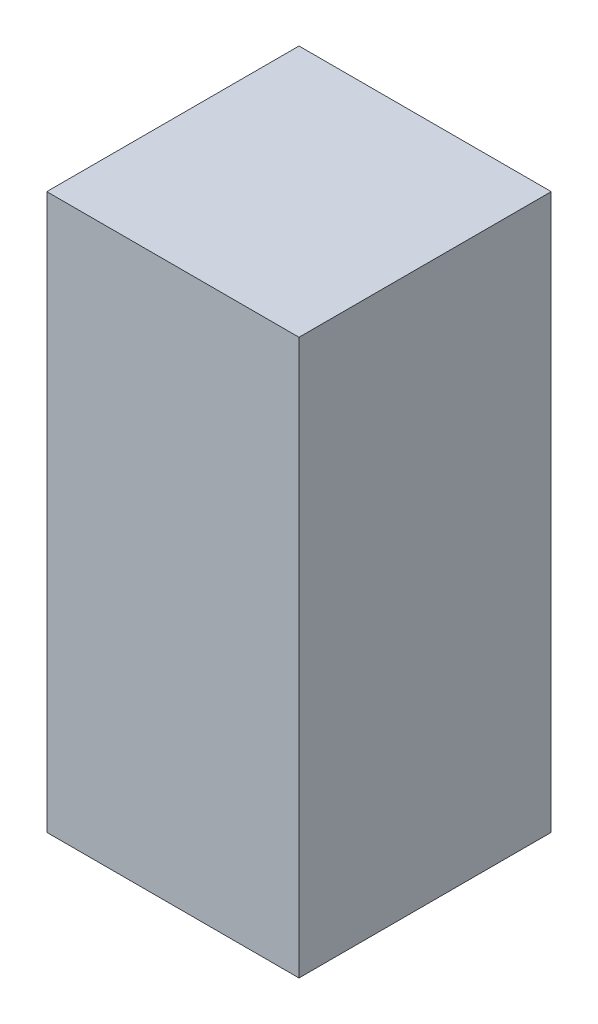
from build123d import *

# Parameters (mm, degrees)
SKETCH1_W           = 25
SKETCH1_H           = 25
BOSS_EXTRUDE1_DEPTH = 55


with BuildPart() as part:
    # Sketch1 → Boss-Extrude1 (new body)
    with BuildSketch(Plane(origin=(0, 0, 0), x_dir=(1, 0, 0), z_dir=(0, 1, 0))):
        Rectangle(SKETCH1_W, SKETCH1_H)
    extrude(amount=BOSS_EXTRUDE1_DEPTH)


solid = part.part
